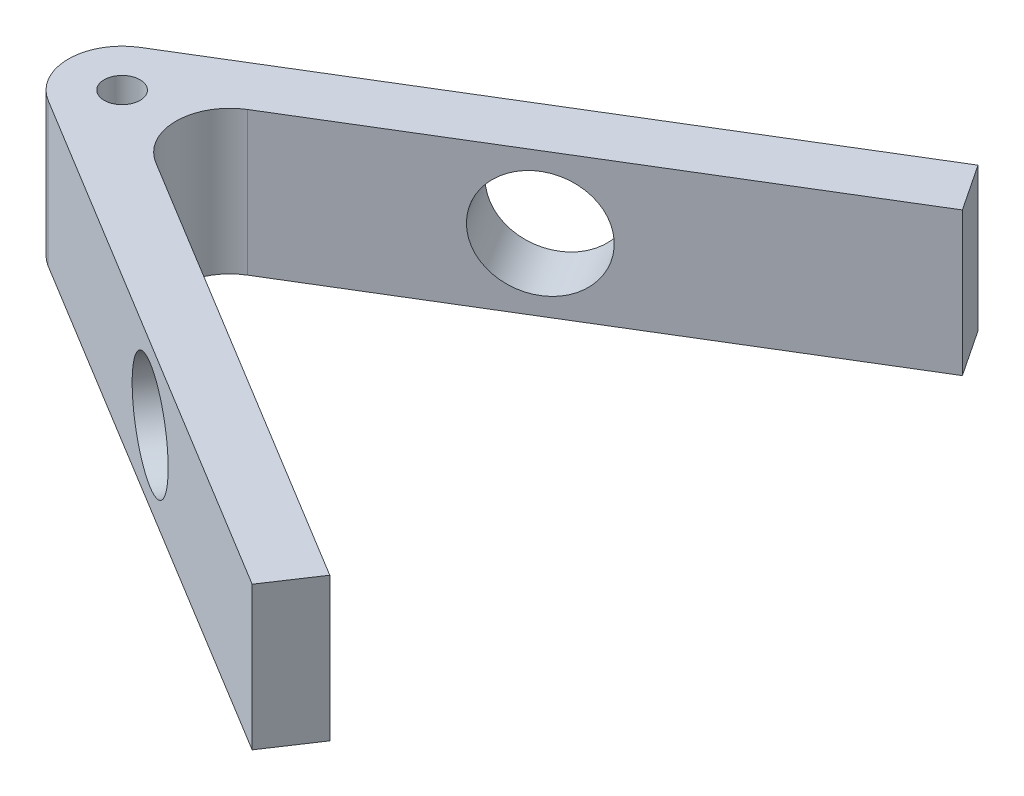
from build123d import *

# Parameters (mm, degrees)
SKETCH1_R           = 5
BOSS_EXTRUDE1_DEPTH = 40
SKETCH2_R           = 15
CUT_EXTRUDE1_DEPTH  = 40
SKETCH3_R           = 15
CUT_EXTRUDE2_DEPTH  = 40


with BuildPart() as part:
    # Sketch1 → Boss-Extrude1 (new body)
    with BuildSketch(Plane(origin=(0, 0, 0), x_dir=(1, 0, 0), z_dir=(0, 1, 0))):
        with BuildLine():
            Line((-37.328010775, 12.814518474), (107.903198598, 101.176817132))
            Line((107.903198598, 101.176817132), (116.545667808, 88.182361447))
            Line((116.545667808, 88.182361447), (-7.328010775, 12.814518474))
            ThreePointArc((-7.328010775, 12.814518474), (-14.531337364, 0), (-7.328010775, -12.814518474))
            Line((-7.328010775, -12.814518474), (116.545667808, -88.182361447))
            Line((116.545667808, -88.182361447), (107.903198598, -101.176817132))
            Line((107.903198598, -101.176817132), (-37.328010775, -12.814518474))
            ThreePointArc((-37.328010775, -12.814518474), (-44.531337364, 0), (-37.328010775, 12.814518474))
        make_face()
        with Locations(Location((-29.531337364, 0, 0), (0, 0, 270))):
            Circle(SKETCH1_R, mode=Mode.SUBTRACT)
    extrude(amount=BOSS_EXTRUDE1_DEPTH)

    # Sketch2 → Cut-Extrude1 (cut)
    with BuildSketch(Plane(origin=(-15.775137276, 0, 25.927825547), x_dir=(0.8543012316036261, 0, 0.5197782274013867), z_dir=(-0.5197782274013867, 0, 0.8543012316036263))):
        with Locations((59.771342119, 20)):
            Circle(SKETCH2_R)
    extrude(amount=-CUT_EXTRUDE1_DEPTH, mode=Mode.SUBTRACT)

    # Sketch3 → Cut-Extrude2 (cut)
    with BuildSketch(Plane(origin=(-15.775137276, 0, -25.927825547), x_dir=(-0.8543012316036261, 0, 0.5197782274013867), z_dir=(-0.5197782274013867, 0, -0.8543012316036263))):
        with Locations((-59.771342119, 20)):
            Circle(SKETCH3_R)
    extrude(amount=-CUT_EXTRUDE2_DEPTH, mode=Mode.SUBTRACT)


solid = part.part
